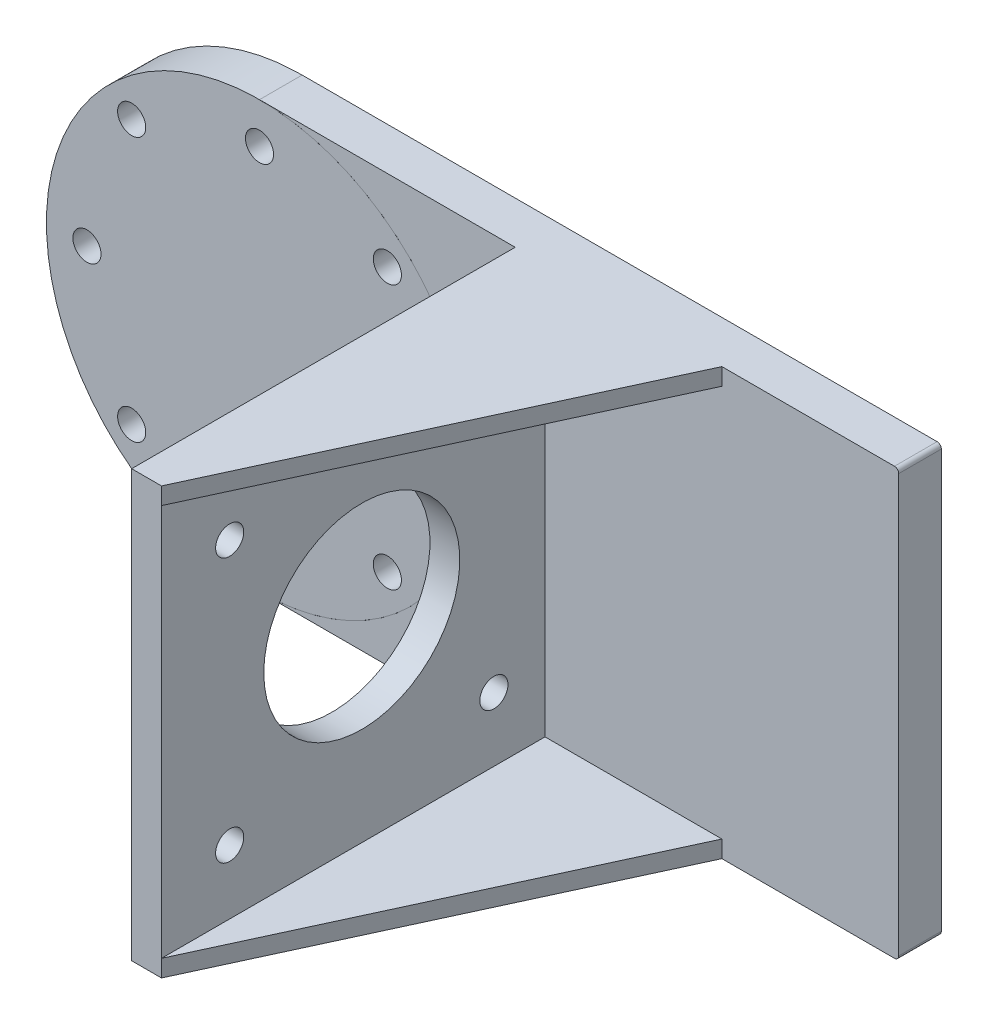
from build123d import *

# Parameters (mm, degrees)
SKETCH_1_R          = 25
EXTRUDE_1_DEPTH     = 5
SKETCH_3_R          = 1.65
CUT_EXTRUDE_1_DEPTH = 5
EXTRUDE_2_DEPTH     = 5
SKETCH_6_W          = 3.5
SKETCH_6_H          = 50
EXTRUDE_3_DEPTH     = 45
SKETCH_7_R          = 11.5
SKETCH_7_R_2        = 1.65
CUT_EXTRUDE_2_DEPTH = 45
EXTRUDE_4_DEPTH     = 2
EXTRUDE_5_DEPTH     = 2
FILLET_1_R          = 0.5


with BuildPart() as part:
    # 草图1 → 凸台-拉伸1 (new body)
    with BuildSketch(Plane.XY):
        Circle(SKETCH_1_R)
    extrude(amount=EXTRUDE_1_DEPTH)

    # 草图3 → 切除-拉伸1 (cut)
    with BuildSketch(Plane.XY.offset(5)):
        with Locations((0, 20.25)):
            Circle(SKETCH_3_R)
        with Locations((-20.25, 0)):
            Circle(SKETCH_3_R)
        with Locations(Location((0, -20.25, 0), (0, 0, 180))):
            Circle(SKETCH_3_R)
        with Locations(Location((20.25, 0, 0), (0, 0, 180))):
            Circle(SKETCH_3_R)
        with Locations((15, 15.5)):
            Circle(SKETCH_3_R)
        with Locations(Location((15, -15.5, 0), (0, 0, 180))):
            Circle(SKETCH_3_R)
        with Locations((-15, -15.5)):
            Circle(SKETCH_3_R)
        with Locations(Location((-15, 15.5, 0), (0, 0, 180))):
            Circle(SKETCH_3_R)
    extrude(amount=-CUT_EXTRUDE_1_DEPTH, mode=Mode.SUBTRACT)


with BuildPart() as body_2:
    # 草图4 → 凸台-拉伸2 (new body)
    with BuildSketch(Plane.XY.offset(5)):
        with BuildLine():
            ThreePointArc((0, 25), (25, 0), (0, -25))
            Line((0, -25), (75, -25))
            Line((75, -25), (75, 25))
            Line((75, 25), (0, 25))
        make_face()
    extrude(amount=-EXTRUDE_2_DEPTH)

    # 草图6 → 凸台-拉伸3 (add)
    with BuildSketch(Plane.XY.offset(5)):
        with Locations((31.75, 0)):
            Rectangle(SKETCH_6_W, SKETCH_6_H)
    extrude(amount=EXTRUDE_3_DEPTH)

    # 草图7 → 切除-拉伸2 (cut)
    with BuildSketch(Plane.ZY.offset(-30)):
        with Locations((26.5, 0)):
            Circle(SKETCH_7_R)
        with Locations((42, 15.5)):
            Circle(SKETCH_7_R_2)
        with Locations((42, -15.5)):
            Circle(SKETCH_7_R_2)
        with Locations((11, -15.5)):
            Circle(SKETCH_7_R_2)
        with Locations((11, 15.5)):
            Circle(SKETCH_7_R_2)
    extrude(amount=-CUT_EXTRUDE_2_DEPTH, mode=Mode.SUBTRACT)

    # 草图9 → 凸台-拉伸4 (add)
    with BuildSketch(Plane.XZ.offset(25)):
        Polygon((33.5, 5), (54.25, 5), (33.5, 50), align=None)
    extrude(amount=-EXTRUDE_4_DEPTH)

    # 草图10 → 凸台-拉伸5 (add)
    with BuildSketch(Plane(origin=(0, 25, 0), x_dir=(1, 0, 0), z_dir=(0, 1, 0))):
        Polygon((33.5, -50), (54.25, -5), (33.5, -5), align=None)
    extrude(amount=-EXTRUDE_5_DEPTH)

    # 圆角1
    fillet_1_edges = [body_2.edges().sort_by_distance(p)[0] for p in [
        (75, 25, 2.5),
        (75, -25, 2.5),
    ]]
    fillet(fillet_1_edges, radius=FILLET_1_R)


solid = Compound([part.part, body_2.part])
